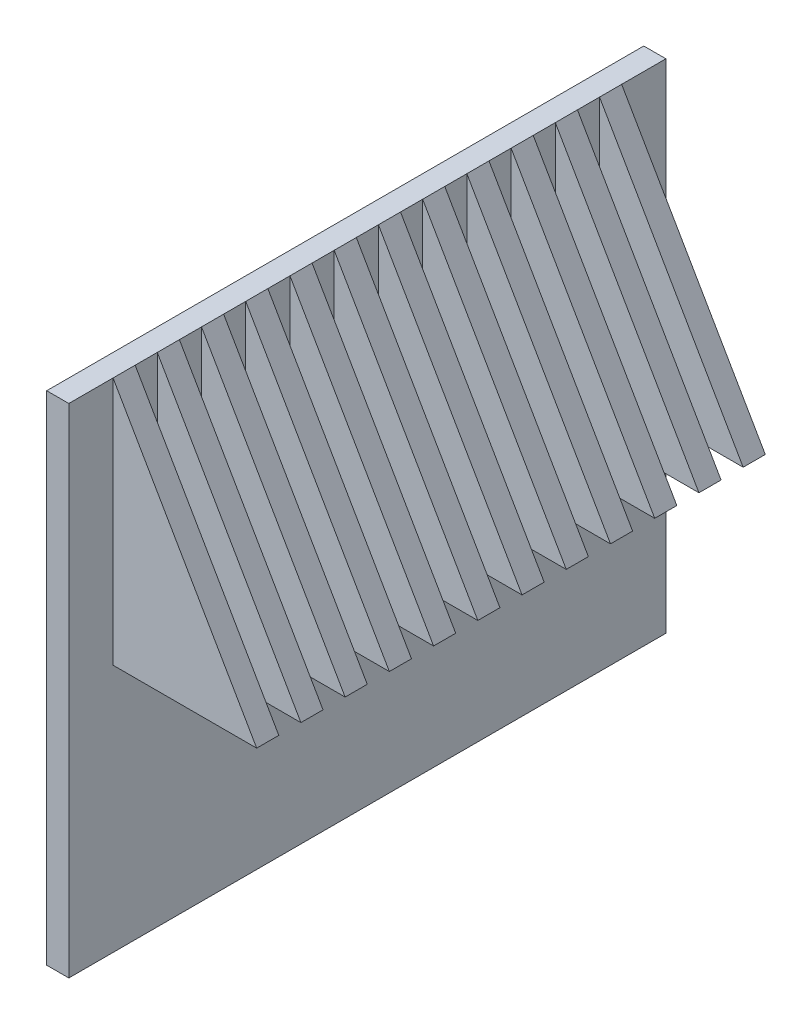
from build123d import *

# Parameters (mm, degrees)
SKETCH2_W           = 270
SKETCH2_H           = 225
BOSS_EXTRUDE1_DEPTH = 10
BOSS_EXTRUDE4_DEPTH = 270
SKETCH5_W           = 64.951905284
SKETCH5_H           = 10
CUT_EXTRUDE2_DEPTH  = 302.95039014


with BuildPart() as part:
    # Sketch2 → Boss-Extrude1 (new body)
    with BuildSketch(Plane(origin=(0, 0, 0), x_dir=(0, 0, -1), z_dir=(1, 0, 0))):
        with Locations((135, 112.5)):
            Rectangle(SKETCH2_W, SKETCH2_H)
    extrude(amount=BOSS_EXTRUDE1_DEPTH)

    # Sketch4 → Boss-Extrude4 (add)
    with BuildSketch(Plane.XY):
        Polygon((10, 225), (74.951905284, 112.5), (10, 112.5), align=None)
    extrude(amount=-BOSS_EXTRUDE4_DEPTH)

    # Sketch5 → Cut-Extrude2 (cut, through all)
    with BuildSketch(Plane.XZ.offset(-112.5)):
        with Locations((42.475952642, -265)):
            Rectangle(SKETCH5_W, SKETCH5_H)
        with Locations((42.475952642, -255)):
            Rectangle(SKETCH5_W, SKETCH5_H)
        with Locations((42.475952642, -235)):
            Rectangle(SKETCH5_W, SKETCH5_H)
        with Locations((42.475952642, -215)):
            Rectangle(SKETCH5_W, SKETCH5_H)
        with Locations((42.475952642, -195)):
            Rectangle(SKETCH5_W, SKETCH5_H)
        with Locations((42.475952642, -175)):
            Rectangle(SKETCH5_W, SKETCH5_H)
        with Locations((42.475952642, -155)):
            Rectangle(SKETCH5_W, SKETCH5_H)
        with Locations((42.475952642, -135)):
            Rectangle(SKETCH5_W, SKETCH5_H)
        with Locations((42.475952642, -115)):
            Rectangle(SKETCH5_W, SKETCH5_H)
        with Locations((42.475952642, -95)):
            Rectangle(SKETCH5_W, SKETCH5_H)
        with Locations((42.475952642, -75)):
            Rectangle(SKETCH5_W, SKETCH5_H)
        with Locations((42.475952642, -55)):
            Rectangle(SKETCH5_W, SKETCH5_H)
        with Locations((42.475952642, -35)):
            Rectangle(SKETCH5_W, SKETCH5_H)
        with Locations((42.475952642, -15)):
            Rectangle(SKETCH5_W, SKETCH5_H)
        with Locations((42.475952642, -5)):
            Rectangle(SKETCH5_W, SKETCH5_H)
    extrude(amount=-CUT_EXTRUDE2_DEPTH, mode=Mode.SUBTRACT)


solid = part.part
